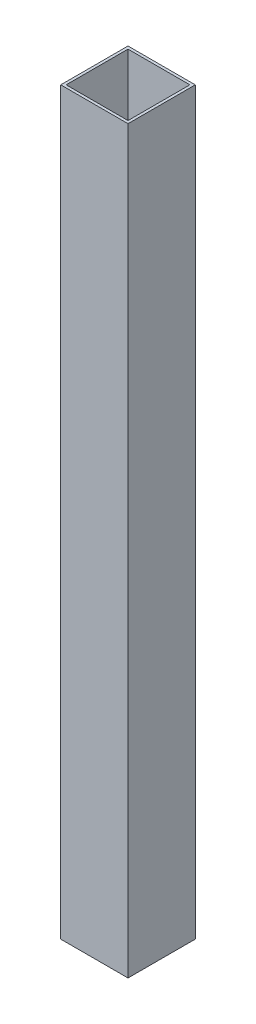
from build123d import *

# Parameters (mm, degrees)
SKETCH1_W           = 38.1
SKETCH1_H           = 38.1
SKETCH1_W_2         = 35.052
SKETCH1_H_2         = 35.052
EXTRUDE_THIN1_DEPTH = 419.1


with BuildPart() as part:
    # Sketch1 → Extrude-Thin1 (new body)
    with BuildSketch(Plane(origin=(0, 0, 0), x_dir=(1, 0, 0), z_dir=(0, 1, 0))):
        Rectangle(SKETCH1_W, SKETCH1_H)
        Rectangle(SKETCH1_W_2, SKETCH1_H_2, mode=Mode.SUBTRACT)
    extrude(amount=EXTRUDE_THIN1_DEPTH)


solid = part.part
